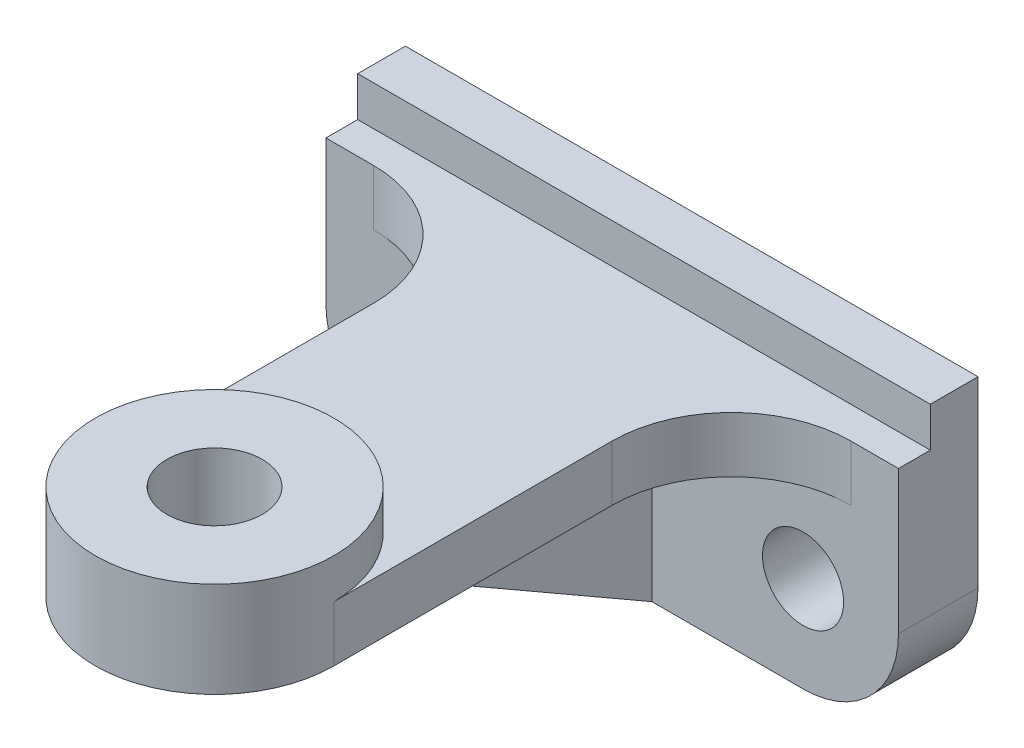
from build123d import *

# Parameters (mm, degrees)
CROQUIS1_W              = 72
CROQUIS1_H              = 35
CROQUIS1_R              = 5.1
SALIENTE_EXTRUIR1_DEPTH = 10
REDONDEO1_R             = 12
CORTAR_EXTRUIR1_REACH   = 76.768
CROQUIS2_W              = 4
CROQUIS2_H              = 5
CROQUIS3_R              = 6
SALIENTE_EXTRUIR2_DEPTH = 7
SALIENTE_EXTRUIR4_START = 5
CROQUIS5_R              = 15
CROQUIS5_R_2            = 6
SALIENTE_EXTRUIR4_DEPTH = 5
REDONDEO2_R             = 15
NERVIO31_REACH          = 87.013
CROQUIS8_WALL_W         = 218.167556508
CROQUIS8_WALL_H         = 10


with BuildPart() as part:
    # Croquis1 → Saliente-Extruir1 (new body)
    with BuildSketch(Plane.XY):
        Rectangle(CROQUIS1_W, CROQUIS1_H)
        with Locations((-24, -5.5)):
            Circle(CROQUIS1_R, mode=Mode.SUBTRACT)
        with Locations((24, -5.5)):
            Circle(CROQUIS1_R, mode=Mode.SUBTRACT)
    extrude(amount=SALIENTE_EXTRUIR1_DEPTH)

    # Redondeo1
    redondeo1_edges = [part.edges().sort_by_distance(p)[0] for p in [
        (36, -17.5, 5),
        (-36, -17.5, 5),
    ]]
    fillet(redondeo1_edges, radius=REDONDEO1_R)

    # Croquis2 → Cortar-Extruir1 (cut, up to next)
    with BuildSketch(Plane.ZY.offset(36), mode=Mode.PRIVATE) as cortar_extruir1_sk1:
        with Locations((8, 15)):
            Rectangle(CROQUIS2_W, CROQUIS2_H)
    cortar_extruir1_tool1 = extrude(cortar_extruir1_sk1.sketch, amount=-CORTAR_EXTRUIR1_REACH, mode=Mode.PRIVATE) & part.part
    add(cortar_extruir1_tool1.solids().sort_by_distance((-36, 15, 8))[0], mode=Mode.SUBTRACT)

    # Croquis3 → Saliente-Extruir2 (add)
    with BuildSketch(Plane(origin=(0, 12.5, 0), x_dir=(1, 0, 0), z_dir=(0, 1, 0))):
        with BuildLine():
            Line((15, -60), (15, -10))
            Line((15, -10), (-15, -10))
            Line((-15, -10), (-15, -60))
            ThreePointArc((-15, -60), (0, -75), (15, -60))
        make_face()
        with Locations(Location((0, -60, 0), (0, 0, 270))):
            Circle(CROQUIS3_R, mode=Mode.SUBTRACT)
    extrude(amount=-SALIENTE_EXTRUIR2_DEPTH)

    # Croquis5 → Saliente-Extruir4 (add)
    with BuildSketch(Plane(origin=(0, 12.5, 0), x_dir=(1, 0, 0), z_dir=(0, 1, 0)).offset(SALIENTE_EXTRUIR4_START)):
        with Locations(Location((0, -60, 0), (0, 0, 270))):
            Circle(CROQUIS5_R)
        with Locations(Location((0, -60, 0), (0, 0, 270))):
            Circle(CROQUIS5_R_2, mode=Mode.SUBTRACT)
    extrude(amount=-SALIENTE_EXTRUIR4_DEPTH)

    # Redondeo2
    redondeo2_edges = [part.edges().sort_by_distance(p)[0] for p in [
        (-15, 9, 10),
        (15, 9, 10),
    ]]
    fillet(redondeo2_edges, radius=REDONDEO2_R)

    # Croquis8 wall → Nervio31 (add, up to next)
    with BuildSketch(Plane(origin=(0, -6, 30), x_dir=(0, 0.498471124258, 0.866906303058), z_dir=(0, -0.866906303058, 0.498471124258)), mode=Mode.PRIVATE) as nervio31_sk1:
        Rectangle(CROQUIS8_WALL_W, CROQUIS8_WALL_H)
    nervio31_tool1 = extrude(nervio31_sk1.sketch, amount=-NERVIO31_REACH, mode=Mode.PRIVATE) - part.part
    add(nervio31_tool1.solids().sort_by_distance((0, -6, 30))[0])


solid = part.part
